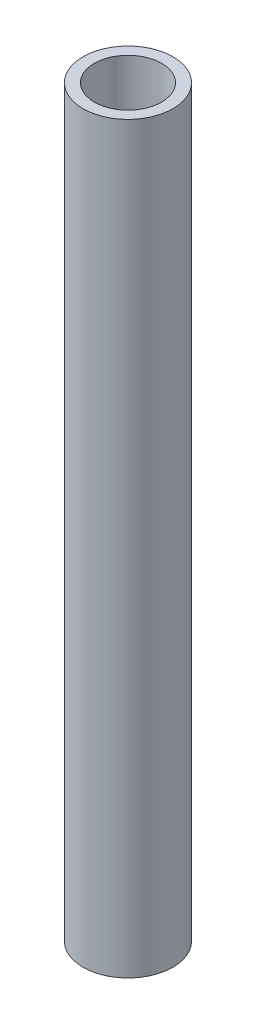
from build123d import *

# Parameters (mm, degrees)
SKETCH1_R           = 12.7
SKETCH1_R_2         = 9.5
BOSS_EXTRUDE1_DEPTH = 210


with BuildPart() as part:
    # Sketch1 → Boss-Extrude1 (new body)
    with BuildSketch(Plane(origin=(0, 0, 0), x_dir=(1, 0, 0), z_dir=(0, 1, 0))):
        with Locations(Location((0, 0, 0), (0, 0, 270))):
            Circle(SKETCH1_R)
        with Locations(Location((0, 0, 0), (0, 0, 270))):
            Circle(SKETCH1_R_2, mode=Mode.SUBTRACT)
    extrude(amount=BOSS_EXTRUDE1_DEPTH)


solid = part.part
